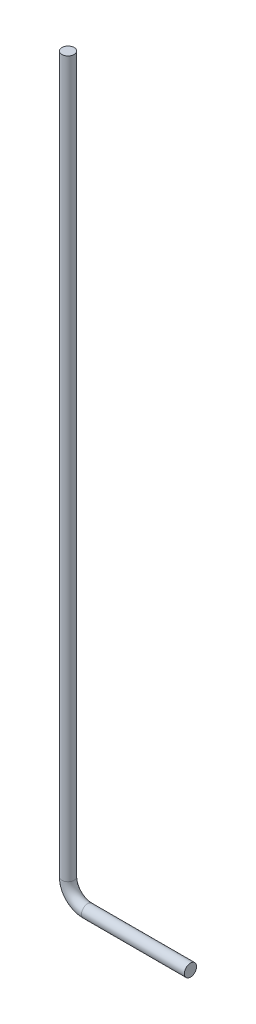
from build123d import *

# Parameters (mm, degrees)
VARREDURA2_PROFILE_R = 2.5


with BuildPart() as part:
    # Varredura2: sweep along a path in Esboço1
    with BuildLine(Plane.XY) as varredura2_path:
        Line((0, 300), (0, 8))
        ThreePointArc((0, 8), (2.343145751, 2.343145751), (8, 0))
        Line((8, 0), (50, 0))
    # Varredura2 profile (on start of the path) → Varredura2 (sweep)
    with BuildSketch(Plane(origin=(0, 300, 0), x_dir=(0, 0, -1), z_dir=(0, -1, 0))):
        Circle(VARREDURA2_PROFILE_R)
    sweep(path=varredura2_path.line)


solid = part.part
